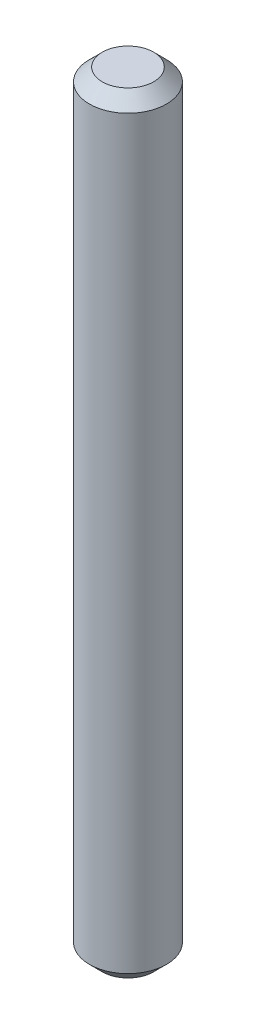
from build123d import *

# Parameters (mm, degrees)
SKETCH1_R           = 1.5
BOSS_EXTRUDE1_DEPTH = 30
CHAMFER1_SIZE       = 0.5


with BuildPart() as part:
    # Sketch1 → Boss-Extrude1 (new body)
    with BuildSketch(Plane(origin=(0, 0, 0), x_dir=(1, 0, 0), z_dir=(0, 1, 0))):
        with Locations(Location((0, 0, 0), (0, 0, 270))):
            Circle(SKETCH1_R)
    extrude(amount=BOSS_EXTRUDE1_DEPTH)

    # Chamfer1
    chamfer1_edges = [part.edges().sort_by_distance(p)[0] for p in [
        (0, 0, -1.5),
        (0, 30, -1.5),
    ]]
    chamfer(chamfer1_edges, length=CHAMFER1_SIZE)


solid = part.part
